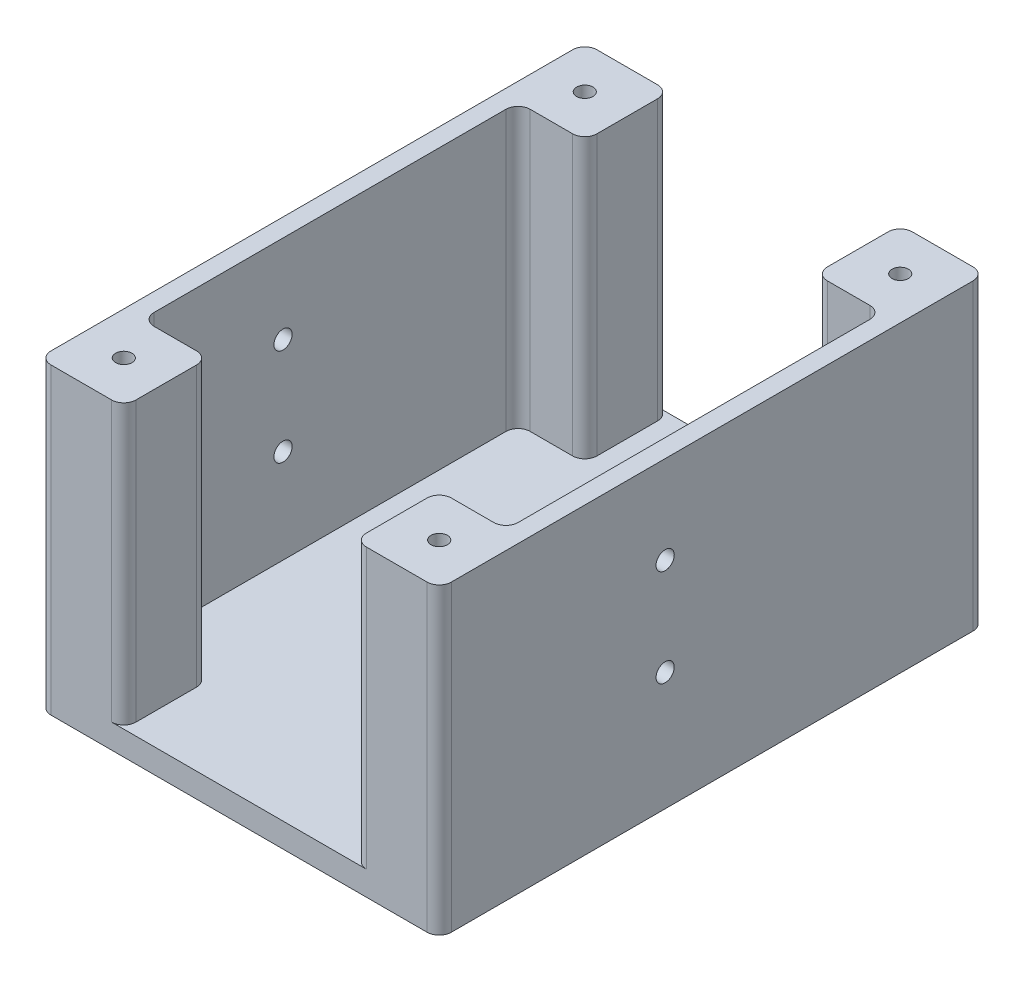
from build123d import *

# Parameters (mm, degrees)
SKETCH1_W               = 66
SKETCH1_H               = 90
BOSS_EXTRUDE1_DEPTH     = 50
SKETCH2_R               = 1.35
CUT_EXTRUDE1_DEPTH      = 8
CUT_EXTRUDE2_DEPTH      = 46
FILLET1_R               = 2
SKETCH4_W               = 38
SKETCH4_H               = 3
CUT_EXTRUDE3_DEPTH      = 46
FILLET4_R               = 2
SKETCH5_R               = 1.6
CUT_EXTRUDE4_DEPTH      = 73.318738927
SKETCH6_W               = 20
SKETCH6_H               = 20
BOSS_EXTRUDE2_DEPTH     = 3.5
FILLET5_R               = 2
CUT_EXTRUDE5_DEPTH      = 93.16289926
CUT_EXTRUDE5_DEPTH_BACK = 93.16289926
SKETCH7_R               = 1.5


with BuildPart() as part:
    # Sketch1 → Boss-Extrude1 (new body)
    with BuildSketch(Plane(origin=(0, 0, 0), x_dir=(1, 0, 0), z_dir=(0, 1, 0))):
        Rectangle(SKETCH1_W, SKETCH1_H)
    extrude(amount=BOSS_EXTRUDE1_DEPTH)

    # Sketch2 → Cut-Extrude1 (cut)
    with BuildSketch(Plane(origin=(0, 50, 0), x_dir=(1, 0, 0), z_dir=(0, 1, 0))):
        with Locations(Location((-26, 38, 0), (0, 0, 270))):
            Circle(SKETCH2_R)
        with Locations(Location((26, 38, 0), (0, 0, 90))):
            Circle(SKETCH2_R)
        with Locations(Location((26, -38, 0), (0, 0, 270))):
            Circle(SKETCH2_R)
        with Locations(Location((-26, -38, 0), (0, 0, 90))):
            Circle(SKETCH2_R)
    extrude(amount=-CUT_EXTRUDE1_DEPTH, mode=Mode.SUBTRACT)

    # Sketch3 → Cut-Extrude2 (cut)
    with BuildSketch(Plane(origin=(0, 50, 0), x_dir=(1, 0, 0), z_dir=(0, 1, 0))):
        Polygon((-19, -42), (19, -42), (19, -31), (30, -31), (30, 31), (19, 31), (19, 42), (-19, 42), (-19, 31), (-30, 31), (-30, -31), (-19, -31), align=None)
    extrude(amount=-CUT_EXTRUDE2_DEPTH, mode=Mode.SUBTRACT)

    # Fillet1
    fillet1_edges = [part.edges().sort_by_distance(p)[0] for p in [
        (-33, 25, -45),
        (33, 25, -45),
        (33, 25, 45),
        (-33, 25, 45),
    ]]
    fillet(fillet1_edges, radius=FILLET1_R)

    # Sketch4 → Cut-Extrude3 (cut)
    with BuildSketch(Plane(origin=(0, 50, 0), x_dir=(1, 0, 0), z_dir=(0, 1, 0))):
        with Locations((0, 43.5)):
            Rectangle(SKETCH4_W, SKETCH4_H)
        with Locations((0, -43.5)):
            Rectangle(SKETCH4_W, SKETCH4_H)
    extrude(amount=-CUT_EXTRUDE3_DEPTH, mode=Mode.SUBTRACT)

    # Fillet4
    fillet4_edges = [part.edges().sort_by_distance(p)[0] for p in [
        (-19, 27, 31),
        (-30, 27, 31),
        (-30, 27, -31),
        (-19, 27, -31),
        (19, 27, -31),
        (30, 27, -31),
        (30, 27, 31),
        (19, 27, 31),
        (-19, 27, -45),
        (19, 27, -45),
        (-19, 27, 45),
        (19, 27, 45),
    ]]
    fillet(fillet4_edges, radius=FILLET4_R)

    # Sketch5 → Cut-Extrude4 (cut, through all)
    with BuildSketch(Plane(origin=(0, 4, 0), x_dir=(1, 0, 0), z_dir=(0, 1, 0))):
        with Locations(Location((-17.5, 0, 0), (0, 0, 270))):
            Circle(SKETCH5_R)
        with Locations(Location((0, 17.5, 0), (0, 0, 270))):
            Circle(SKETCH5_R)
        with Locations(Location((0, -17.5, 0), (0, 0, 90))):
            Circle(SKETCH5_R)
        with Locations(Location((17.5, 0, 0), (0, 0, 90))):
            Circle(SKETCH5_R)
    extrude(amount=-CUT_EXTRUDE4_DEPTH, mode=Mode.SUBTRACT)

    # Sketch6 → Boss-Extrude2 (add)
    with BuildSketch(Plane(origin=(0, 4, 0), x_dir=(1, 0, 0), z_dir=(0, 1, 0))):
        Rectangle(SKETCH6_W, SKETCH6_H)
    extrude(amount=BOSS_EXTRUDE2_DEPTH)

    # Fillet5
    fillet5_edges = [part.edges().sort_by_distance(p)[0] for p in [
        (-10, 5.75, -10),
        (-10, 5.75, 10),
        (10, 5.75, 10),
        (10, 5.75, -10),
    ]]
    fillet(fillet5_edges, radius=FILLET5_R)

    # Sketch7 → Cut-Extrude5 (cut, two sides: drawn at the far end of the back side and taken through both)
    with BuildSketch(Plane(origin=(-30, 0, 0), x_dir=(0, 0, -1), z_dir=(1, 0, 0)).offset(-CUT_EXTRUDE5_DEPTH_BACK)):
        with Locations((-7.75, 19.5)):
            Circle(SKETCH7_R)
        with Locations((-7.75, 35.5)):
            Circle(SKETCH7_R)
    extrude(amount=CUT_EXTRUDE5_DEPTH + CUT_EXTRUDE5_DEPTH_BACK, mode=Mode.SUBTRACT)


solid = part.part
